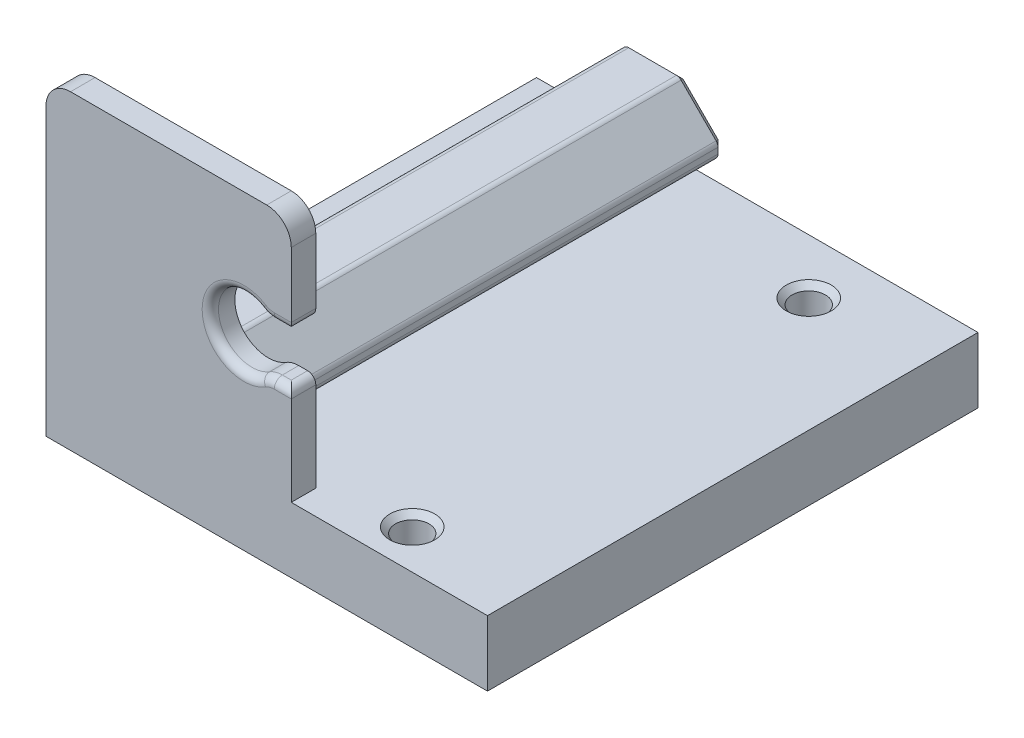
from build123d import *

# Parameters (mm, degrees)
BOSS_EXTRUDE1_DEPTH = 3
SKETCH2_W           = 54
SKETCH2_H           = 8
BOSS_EXTRUDE2_DEPTH = 57
SKETCH3_R           = 2.05
CUT_EXTRUDE1_DEPTH  = 57
BOSS_EXTRUDE3_DEPTH = 57
FILLET1_R           = 3
CUT_EXTRUDE2_DEPTH  = 6
FILLET2_R           = 1
FILLET3_R           = 0.8
CHAMFER1_SIZE       = 0.8
CHAMFER2_SIZE       = 0.7


with BuildPart() as part:
    # Sketch1 → Boss-Extrude1 (new body)
    with BuildSketch(Plane.XY):
        Polygon((54, 0), (54, 8), (30, 8), (30, 38), (0, 38), (0, 0), align=None)
    extrude(amount=BOSS_EXTRUDE1_DEPTH)

    # Sketch2 → Boss-Extrude2 (add)
    with BuildSketch(Plane(origin=(0, 0, 0), x_dir=(-1, 0, 0), z_dir=(0, 0, -1))):
        with Locations((-27, 4)):
            Rectangle(SKETCH2_W, SKETCH2_H)
    extrude(amount=BOSS_EXTRUDE2_DEPTH)

    # Sketch3 → Cut-Extrude1 (cut)
    with BuildSketch(Plane.XZ):
        with Locations(Location((40, -1.8, 0), (0, 0, 270))):
            Circle(SKETCH3_R)
        with Locations(Location((40, -50.3, 0), (0, 0, 270))):
            Circle(SKETCH3_R)
    extrude(amount=-CUT_EXTRUDE1_DEPTH, mode=Mode.SUBTRACT)

    # Sketch4 → Boss-Extrude3 (add)
    with BuildSketch(Plane(origin=(0, 0, 0), x_dir=(-1, 0, 0), z_dir=(0, 0, -1))):
        Polygon((-18, 8), (-18, 11), (-23, 11), (-23, 12.85), (-18.25, 17.6), (-11.75, 17.6), (-7, 12.85), (-7, 11), (-12, 11), (-12, 8), align=None)
    extrude(amount=BOSS_EXTRUDE3_DEPTH)

    # Fillet1
    fillet1_edges = [part.edges().sort_by_distance(p)[0] for p in [
        (0, 38, 1.5),
        (30, 38, 1.5),
    ]]
    fillet(fillet1_edges, radius=FILLET1_R)

    # Sketch5 → Cut-Extrude2 (cut)
    with BuildSketch(Plane.XY.offset(3)):
        with BuildLine():
            Line((27.915844453, 26.05), (30, 26.05))
            Line((30, 26.05), (30, 19.95))
            Line((30, 19.95), (27.915844453, 19.95))
            ThreePointArc((27.915844453, 19.95), (27.100066936, 19.836954631), (26.345769332, 19.506338028))
            ThreePointArc((26.345769332, 19.506338028), (20.1, 23), (26.345769332, 26.493661972))
            ThreePointArc((26.345769332, 26.493661972), (27.100066936, 26.163045369), (27.915844453, 26.05))
        make_face()
    extrude(amount=-CUT_EXTRUDE2_DEPTH, mode=Mode.SUBTRACT)

    # Fillet2
    fillet2_edges = [part.edges().sort_by_distance(p)[0] for p in [
        (30, 26.05, 1.5),
        (30, 19.95, 1.5),
        (28.957922227, 26.05, 3),
        (27.100066936, 26.163045369, 3),
        (20.1, 23, 3),
        (27.100066936, 19.836954631, 3),
        (28.957922227, 19.95, 3),
    ]]
    fillet(fillet2_edges, radius=FILLET2_R)

    # Fillet3
    fillet3_edges = [part.edges().sort_by_distance(p)[0] for p in [
        (7, 11, -28.5),
        (7, 12.85, -28.5),
        (11.75, 17.6, -28.5),
        (18.25, 17.6, -28.5),
        (23, 12.85, -28.5),
        (23, 11, -28.5),
    ]]
    fillet(fillet3_edges, radius=FILLET3_R)

    # Chamfer1
    chamfer1_edges = [part.edges().sort_by_distance(p)[0] for p in [
        (20.1, 11, -57),
        (23, 12.159314575, -57),
        (7, 12.159314575, -57),
        (9.375, 15.225, -57),
        (15, 17.6, -57),
        (20.625, 15.225, -57),
        (22.939103626, 12.824775896, -57),
        (18.224775896, 17.539103626, -57),
        (11.775224104, 17.539103626, -57),
        (7.060896374, 12.824775896, -57),
        (7.234314575, 11.234314575, -57),
        (22.765685425, 11.234314575, -57),
        (12, 9.5, -57),
        (9.9, 11, -57),
        (18, 9.5, -57),
    ]]
    chamfer(chamfer1_edges, length=CHAMFER1_SIZE)

    # Chamfer2
    chamfer2_edges = [part.edges().sort_by_distance(p)[0] for p in [
        (40, 8, -48.25),
        (40, 0, -48.25),
        (40, 8, 0.25),
        (40, 0, 0.25),
    ]]
    chamfer(chamfer2_edges, length=CHAMFER2_SIZE)


solid = part.part
